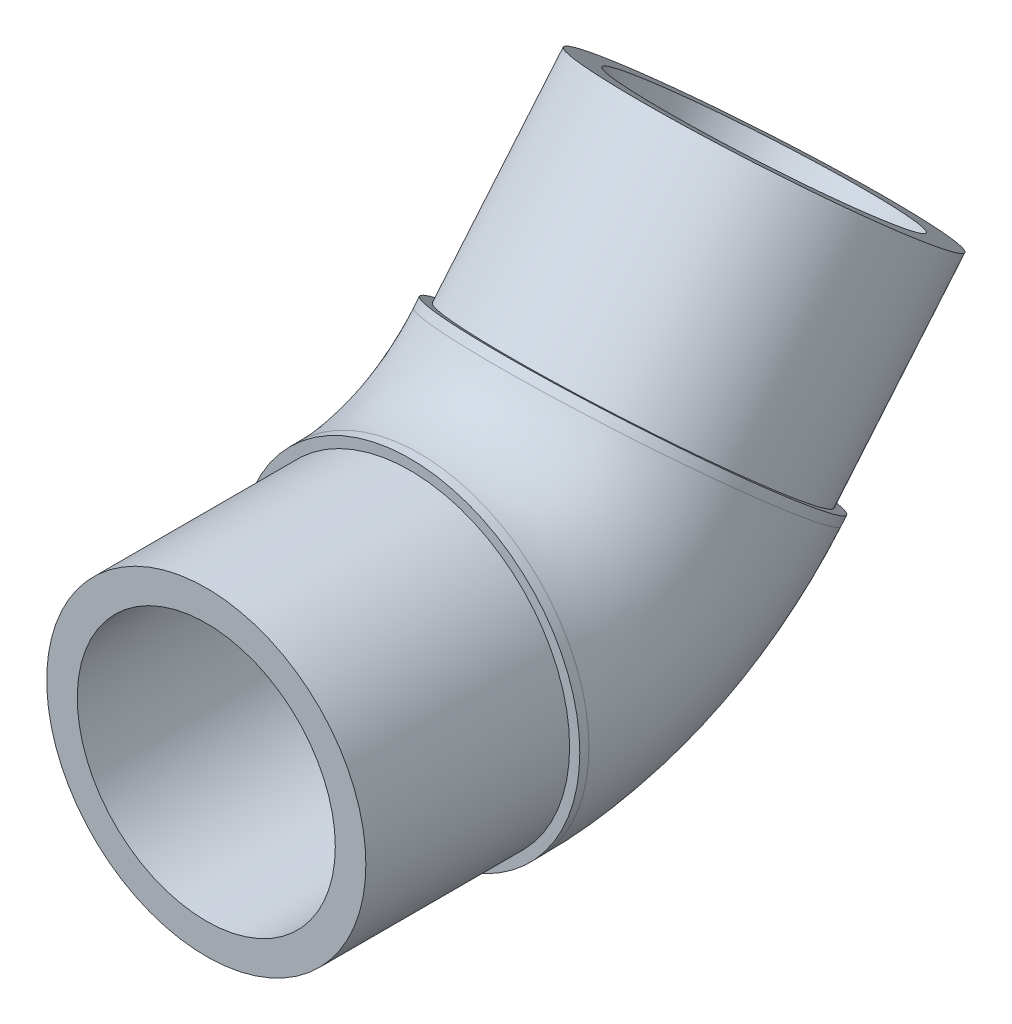
from build123d import *

# Parameters (mm, degrees)
ESQUISSE1_R             = 25
ESQUISSE1_R_2           = 19
ESQUISSE3_R             = 27.5
ESQUISSE3_R_2           = 23.5
ENL_V_MAT_EXTRU_1_DEPTH = 30
ESQUISSE4_R             = 27.5
ESQUISSE4_R_2           = 23.5
ENL_V_MAT_EXTRU_2_DEPTH = 30


with BuildPart() as part:
    # Balayage1: sweep along a path in Esquisse2
    with BuildLine(Plane(origin=(0, 0, 0), x_dir=(0, 0, -1), z_dir=(1, 0, 0))) as balayage1_path:
        Line((0, 0), (31.347693674, 0))
        ThreePointArc((31.347693674, 0), (48.252424143, 3.747688519), (61.989471399, 14.288495613))
        Line((61.989471399, 14.288495613), (82.139380484, 38.302222156))
    # Esquisse1 → Balayage1 (sweep)
    with BuildSketch(Plane.XY):
        Circle(ESQUISSE1_R)
        Circle(ESQUISSE1_R_2, mode=Mode.SUBTRACT)
    sweep(path=balayage1_path.line)

    # Esquisse3 → Enlèv. mat.-Extru.1 (cut)
    with BuildSketch(Plane.XY):
        Circle(ESQUISSE3_R)
        Circle(ESQUISSE3_R_2, mode=Mode.SUBTRACT)
    extrude(amount=-ENL_V_MAT_EXTRU_1_DEPTH, mode=Mode.SUBTRACT)

    # Esquisse4 → Enlèv. mat.-Extru.2 (cut)
    with BuildSketch(Plane(origin=(0, 62.922415981, -52.798176043), x_dir=(1, 0, 0), z_dir=(0, 0.7660444431189795, -0.6427876096865377))):
        with Locations((0, 38.302222156)):
            Circle(ESQUISSE4_R)
        with Locations(Location((0, 38.302222156, 0), (0, 0, 270))):
            Circle(ESQUISSE4_R_2, mode=Mode.SUBTRACT)
    extrude(amount=-ENL_V_MAT_EXTRU_2_DEPTH, mode=Mode.SUBTRACT)


solid = part.part
